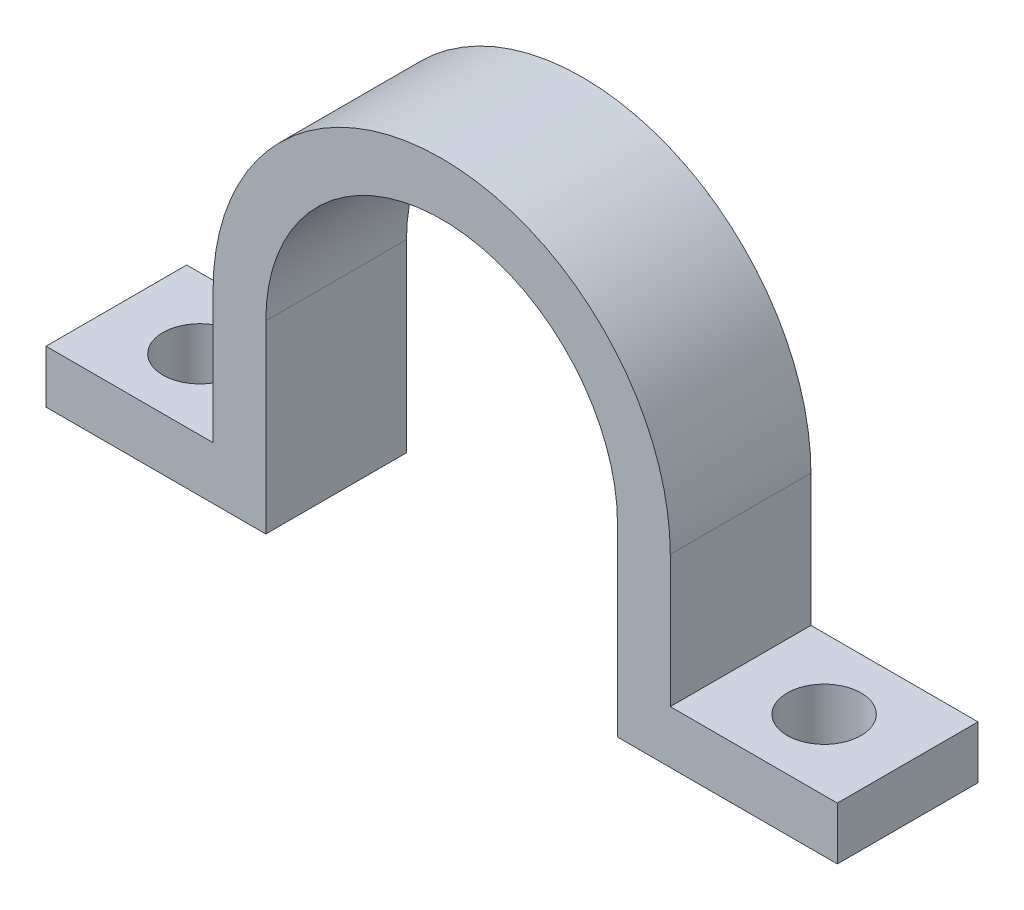
from build123d import *

# Parameters (mm, degrees)
CLAMP_DEPTH      = 8
SKETCH2_R        = 2.1
SCREW_HOLE_DEPTH = 32.472209964


with BuildPart() as part:
    # Sketch1 → Clamp (new body)
    with BuildSketch(Plane.XY):
        with BuildLine():
            Line((-22.5, -7.5), (-13, -7.5))
            Line((-13, -7.5), (-13, 0))
            ThreePointArc((-13, 0), (0, 13), (13, 0))
            Line((13, 0), (13, -7.5))
            Line((13, -7.5), (22.5, -7.5))
            Line((22.5, -7.5), (22.5, -10.5))
            Line((22.5, -10.5), (10, -10.5))
            Line((10, -10.5), (10, 0))
            ThreePointArc((10, 0), (0, 10), (-10, 0))
            Line((-10, 0), (-10, -10.5))
            Line((-10, -10.5), (-22.5, -10.5))
            Line((-22.5, -10.5), (-22.5, -7.5))
        make_face()
    extrude(amount=CLAMP_DEPTH)

    # Sketch2 → Screw Hole (cut, through all)
    with BuildSketch(Plane(origin=(0, -7.5, 0), x_dir=(1, 0, 0), z_dir=(0, 1, 0))):
        with Locations((-17.75, -4)):
            Circle(SKETCH2_R)
        with Locations((17.75, -4)):
            Circle(SKETCH2_R)
    extrude(amount=-SCREW_HOLE_DEPTH, mode=Mode.SUBTRACT)


solid = part.part
